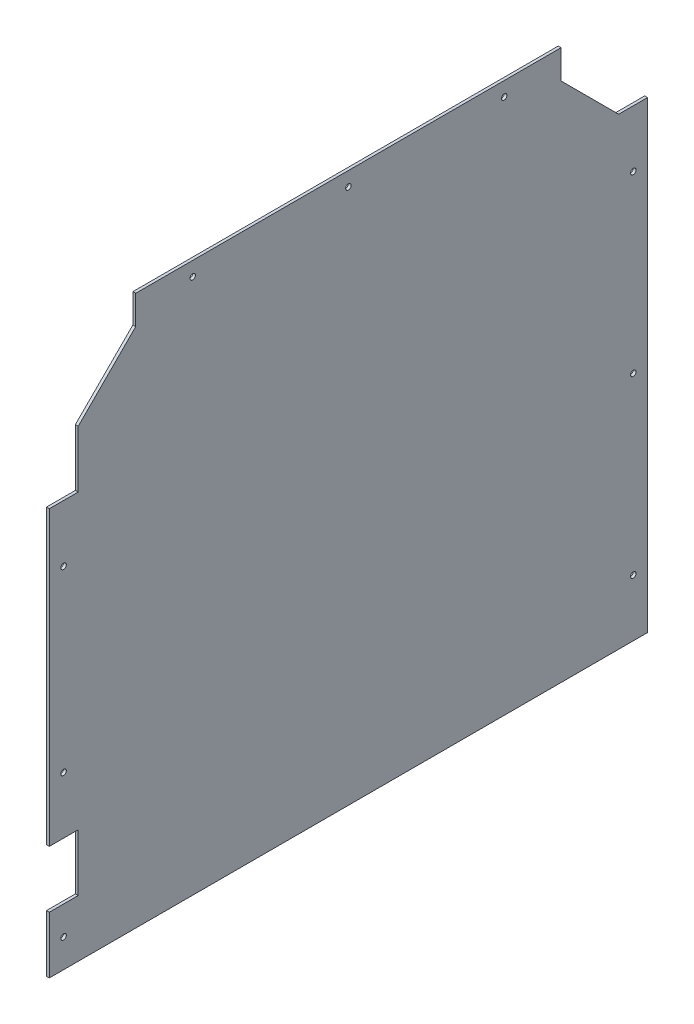
from build123d import *

# Parameters (mm, degrees)
SKETCH1_W            = 630
SKETCH1_H            = 579
BOSS_EXTRUDE1_DEPTH  = 1.5
CUT_EXTRUDE1_DEPTH   = 428.836709505
SKETCH3_W            = 30.414213562
SKETCH3_H            = 60
CUT_EXTRUDE2_DEPTH   = 428.836709505
M5_CLEARANCE_HOLE1_D = 5.8


with BuildPart() as part:
    # Sketch1 → Boss-Extrude1 (new, symmetric)
    with BuildSketch(Plane(origin=(0, 0, 0), x_dir=(0, 0, -1), z_dir=(1, 0, 0))):
        Rectangle(SKETCH1_W, SKETCH1_H)
    extrude(amount=BOSS_EXTRUDE1_DEPTH, both=True)

    # Sketch2 → Cut-Extrude1 (cut, through all)
    with BuildSketch(Plane.ZY.offset(1.5)):
        Polygon((-224, 289.5), (-224, 259.085786438), (-284.585786438, 198.5), (-315, 198.5), (-315, 289.5), align=None)
        Polygon((224, 289.5), (224, 259.085786438), (284.585786438, 198.5), (315, 198.5), (315, 289.5), align=None)
    extrude(amount=-CUT_EXTRUDE1_DEPTH, mode=Mode.SUBTRACT)

    # Sketch3 → Cut-Extrude2 (cut, through all)
    with BuildSketch(Plane.ZY.offset(1.5)):
        with Locations((299.792893219, 168.5)):
            Rectangle(SKETCH3_W, SKETCH3_H)
        with Locations((299.792893219, -199.5)):
            Rectangle(SKETCH3_W, SKETCH3_H)
    extrude(amount=-CUT_EXTRUDE2_DEPTH, mode=Mode.SUBTRACT)

    # M5 Clearance Hole1 (through all)
    with Locations(Plane.ZY.offset(1.5)):
        with Locations((-164, 274.5), (0, 274.5), (164, 274.5), (300, 78.5), (300, -109.5), (300, -259.5), (-300, -229.5), (-300, -45.5), (-300, 138.5)):
            Hole(M5_CLEARANCE_HOLE1_D / 2)


solid = part.part
